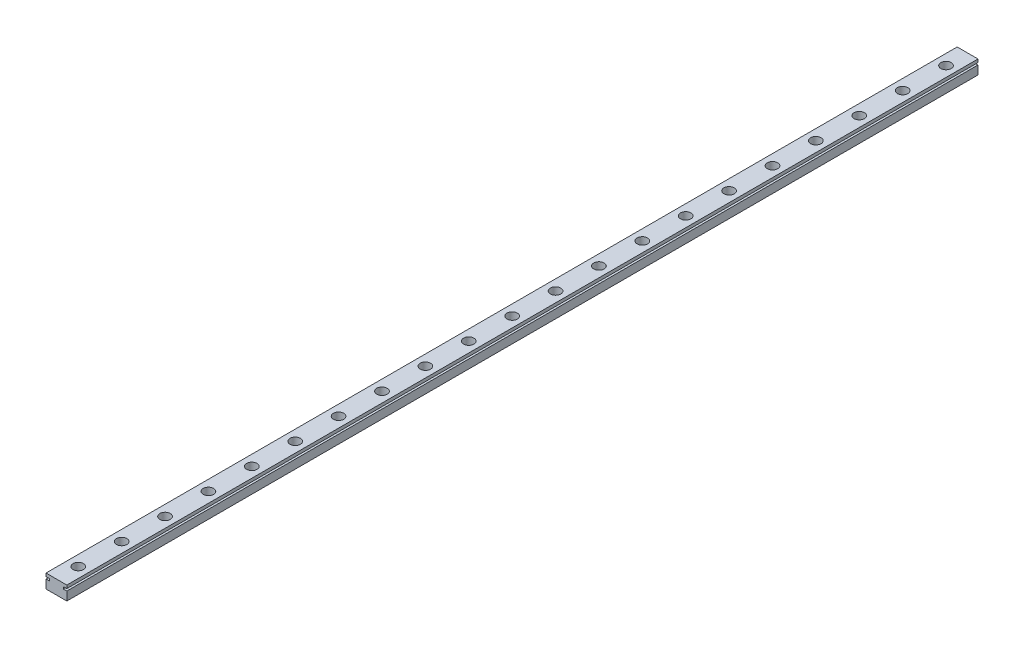
from build123d import *

# Parameters (mm, degrees)
BOSS_EXTRU_1_DEPTH      = 525
ESQUISSE2_R             = 3
ENL_V_MAT_EXTRU_1_DEPTH = 4.5
ENL_V_MAT_EXTRU_2_REACH = 527.109
ESQUISSE3_R             = 1.75


with BuildPart() as part:
    # Esquisse1 → Boss.-Extru.1 (new body)
    with BuildSketch(Plane.XY):
        Polygon((-2.287966089, -3.148854962), (9.712033911, -3.148854962), (9.712033911, 1.851145038), (7.712033911, 1.851145038), (7.712033911, 3.051145038), (9.712033911, 3.051145038), (9.712033911, 4.851145038), (-2.287966089, 4.851145038), (-2.287966089, 3.051145038), (-0.287966089, 3.051145038), (-0.287966089, 1.851145038), (-2.287966089, 1.851145038), align=None)
    extrude(amount=BOSS_EXTRU_1_DEPTH)

    # Esquisse2 → Enlèv. mat.-Extru.1 (cut)
    with BuildSketch(Plane(origin=(0, 4.851145038, 0), x_dir=(1, 0, 0), z_dir=(0, 1, 0))):
        with Locations(Location((3.792841972, -512.5, 0), (0, 0, 180))):
            Circle(ESQUISSE2_R)
        with Locations(Location((3.792841972, -487.5, 0), (0, 0, 180))):
            Circle(ESQUISSE2_R)
        with Locations(Location((3.792841972, -462.5, 0), (0, 0, 180))):
            Circle(ESQUISSE2_R)
        with Locations(Location((3.792841972, -437.5, 0), (0, 0, 180))):
            Circle(ESQUISSE2_R)
        with Locations(Location((3.792841972, -412.5, 0), (0, 0, 180))):
            Circle(ESQUISSE2_R)
        with Locations(Location((3.792841972, -387.5, 0), (0, 0, 180))):
            Circle(ESQUISSE2_R)
        with Locations(Location((3.792841972, -362.5, 0), (0, 0, 180))):
            Circle(ESQUISSE2_R)
        with Locations(Location((3.792841972, -337.5, 0), (0, 0, 180))):
            Circle(ESQUISSE2_R)
        with Locations(Location((3.792841972, -312.5, 0), (0, 0, 180))):
            Circle(ESQUISSE2_R)
        with Locations(Location((3.792841972, -287.5, 0), (0, 0, 180))):
            Circle(ESQUISSE2_R)
        with Locations(Location((3.792841972, -262.5, 0), (0, 0, 180))):
            Circle(ESQUISSE2_R)
        with Locations(Location((3.792841972, -237.5, 0), (0, 0, 180))):
            Circle(ESQUISSE2_R)
        with Locations(Location((3.792841972, -212.5, 0), (0, 0, 180))):
            Circle(ESQUISSE2_R)
        with Locations(Location((3.792841972, -187.5, 0), (0, 0, 180))):
            Circle(ESQUISSE2_R)
        with Locations(Location((3.792841972, -162.5, 0), (0, 0, 180))):
            Circle(ESQUISSE2_R)
        with Locations(Location((3.792841972, -137.5, 0), (0, 0, 180))):
            Circle(ESQUISSE2_R)
        with Locations(Location((3.792841972, -112.5, 0), (0, 0, 180))):
            Circle(ESQUISSE2_R)
        with Locations(Location((3.792841972, -87.5, 0), (0, 0, 180))):
            Circle(ESQUISSE2_R)
        with Locations(Location((3.792841972, -62.5, 0), (0, 0, 180))):
            Circle(ESQUISSE2_R)
        with Locations(Location((3.792841972, -37.5, 0), (0, 0, 180))):
            Circle(ESQUISSE2_R)
        with Locations(Location((3.792841972, -12.5, 0), (0, 0, 180))):
            Circle(ESQUISSE2_R)
    extrude(amount=-ENL_V_MAT_EXTRU_1_DEPTH, mode=Mode.SUBTRACT)

    # Esquisse3 → Enlèv. mat.-Extru.2 (cut, up to next)
    with BuildSketch(Plane(origin=(0, 0.351145038, 0), x_dir=(1, 0, 0), z_dir=(0, 1, 0)), mode=Mode.PRIVATE) as enl_v_mat_extru_2_sk1:
        with Locations(Location((3.792841972, -512.5, 0), (0, 0, 180))):
            Circle(ESQUISSE3_R)
    enl_v_mat_extru_2_tool1 = extrude(enl_v_mat_extru_2_sk1.sketch, amount=-ENL_V_MAT_EXTRU_2_REACH, mode=Mode.PRIVATE) & part.part
    # Esquisse3 → Enlèv. mat.-Extru.2 (cut, up to next)
    with BuildSketch(Plane(origin=(0, 0.351145038, 0), x_dir=(1, 0, 0), z_dir=(0, 1, 0)), mode=Mode.PRIVATE) as enl_v_mat_extru_2_sk2:
        with Locations(Location((3.792841972, -487.5, 0), (0, 0, 180))):
            Circle(ESQUISSE3_R)
    enl_v_mat_extru_2_tool2 = extrude(enl_v_mat_extru_2_sk2.sketch, amount=-ENL_V_MAT_EXTRU_2_REACH, mode=Mode.PRIVATE) & part.part
    # Esquisse3 → Enlèv. mat.-Extru.2 (cut, up to next)
    with BuildSketch(Plane(origin=(0, 0.351145038, 0), x_dir=(1, 0, 0), z_dir=(0, 1, 0)), mode=Mode.PRIVATE) as enl_v_mat_extru_2_sk3:
        with Locations(Location((3.792841972, -462.5, 0), (0, 0, 180))):
            Circle(ESQUISSE3_R)
    enl_v_mat_extru_2_tool3 = extrude(enl_v_mat_extru_2_sk3.sketch, amount=-ENL_V_MAT_EXTRU_2_REACH, mode=Mode.PRIVATE) & part.part
    # Esquisse3 → Enlèv. mat.-Extru.2 (cut, up to next)
    with BuildSketch(Plane(origin=(0, 0.351145038, 0), x_dir=(1, 0, 0), z_dir=(0, 1, 0)), mode=Mode.PRIVATE) as enl_v_mat_extru_2_sk4:
        with Locations(Location((3.792841972, -437.5, 0), (0, 0, 180))):
            Circle(ESQUISSE3_R)
    enl_v_mat_extru_2_tool4 = extrude(enl_v_mat_extru_2_sk4.sketch, amount=-ENL_V_MAT_EXTRU_2_REACH, mode=Mode.PRIVATE) & part.part
    # Esquisse3 → Enlèv. mat.-Extru.2 (cut, up to next)
    with BuildSketch(Plane(origin=(0, 0.351145038, 0), x_dir=(1, 0, 0), z_dir=(0, 1, 0)), mode=Mode.PRIVATE) as enl_v_mat_extru_2_sk5:
        with Locations(Location((3.792841972, -412.5, 0), (0, 0, 180))):
            Circle(ESQUISSE3_R)
    enl_v_mat_extru_2_tool5 = extrude(enl_v_mat_extru_2_sk5.sketch, amount=-ENL_V_MAT_EXTRU_2_REACH, mode=Mode.PRIVATE) & part.part
    # Esquisse3 → Enlèv. mat.-Extru.2 (cut, up to next)
    with BuildSketch(Plane(origin=(0, 0.351145038, 0), x_dir=(1, 0, 0), z_dir=(0, 1, 0)), mode=Mode.PRIVATE) as enl_v_mat_extru_2_sk6:
        with Locations(Location((3.792841972, -387.5, 0), (0, 0, 180))):
            Circle(ESQUISSE3_R)
    enl_v_mat_extru_2_tool6 = extrude(enl_v_mat_extru_2_sk6.sketch, amount=-ENL_V_MAT_EXTRU_2_REACH, mode=Mode.PRIVATE) & part.part
    # Esquisse3 → Enlèv. mat.-Extru.2 (cut, up to next)
    with BuildSketch(Plane(origin=(0, 0.351145038, 0), x_dir=(1, 0, 0), z_dir=(0, 1, 0)), mode=Mode.PRIVATE) as enl_v_mat_extru_2_sk7:
        with Locations(Location((3.792841972, -362.5, 0), (0, 0, 180))):
            Circle(ESQUISSE3_R)
    enl_v_mat_extru_2_tool7 = extrude(enl_v_mat_extru_2_sk7.sketch, amount=-ENL_V_MAT_EXTRU_2_REACH, mode=Mode.PRIVATE) & part.part
    # Esquisse3 → Enlèv. mat.-Extru.2 (cut, up to next)
    with BuildSketch(Plane(origin=(0, 0.351145038, 0), x_dir=(1, 0, 0), z_dir=(0, 1, 0)), mode=Mode.PRIVATE) as enl_v_mat_extru_2_sk8:
        with Locations(Location((3.792841972, -337.5, 0), (0, 0, 180))):
            Circle(ESQUISSE3_R)
    enl_v_mat_extru_2_tool8 = extrude(enl_v_mat_extru_2_sk8.sketch, amount=-ENL_V_MAT_EXTRU_2_REACH, mode=Mode.PRIVATE) & part.part
    # Esquisse3 → Enlèv. mat.-Extru.2 (cut, up to next)
    with BuildSketch(Plane(origin=(0, 0.351145038, 0), x_dir=(1, 0, 0), z_dir=(0, 1, 0)), mode=Mode.PRIVATE) as enl_v_mat_extru_2_sk9:
        with Locations(Location((3.792841972, -312.5, 0), (0, 0, 180))):
            Circle(ESQUISSE3_R)
    enl_v_mat_extru_2_tool9 = extrude(enl_v_mat_extru_2_sk9.sketch, amount=-ENL_V_MAT_EXTRU_2_REACH, mode=Mode.PRIVATE) & part.part
    # Esquisse3 → Enlèv. mat.-Extru.2 (cut, up to next)
    with BuildSketch(Plane(origin=(0, 0.351145038, 0), x_dir=(1, 0, 0), z_dir=(0, 1, 0)), mode=Mode.PRIVATE) as enl_v_mat_extru_2_sk10:
        with Locations(Location((3.792841972, -287.5, 0), (0, 0, 180))):
            Circle(ESQUISSE3_R)
    enl_v_mat_extru_2_tool10 = extrude(enl_v_mat_extru_2_sk10.sketch, amount=-ENL_V_MAT_EXTRU_2_REACH, mode=Mode.PRIVATE) & part.part
    # Esquisse3 → Enlèv. mat.-Extru.2 (cut, up to next)
    with BuildSketch(Plane(origin=(0, 0.351145038, 0), x_dir=(1, 0, 0), z_dir=(0, 1, 0)), mode=Mode.PRIVATE) as enl_v_mat_extru_2_sk11:
        with Locations(Location((3.792841972, -262.5, 0), (0, 0, 180))):
            Circle(ESQUISSE3_R)
    enl_v_mat_extru_2_tool11 = extrude(enl_v_mat_extru_2_sk11.sketch, amount=-ENL_V_MAT_EXTRU_2_REACH, mode=Mode.PRIVATE) & part.part
    # Esquisse3 → Enlèv. mat.-Extru.2 (cut, up to next)
    with BuildSketch(Plane(origin=(0, 0.351145038, 0), x_dir=(1, 0, 0), z_dir=(0, 1, 0)), mode=Mode.PRIVATE) as enl_v_mat_extru_2_sk12:
        with Locations(Location((3.792841972, -237.5, 0), (0, 0, 180))):
            Circle(ESQUISSE3_R)
    enl_v_mat_extru_2_tool12 = extrude(enl_v_mat_extru_2_sk12.sketch, amount=-ENL_V_MAT_EXTRU_2_REACH, mode=Mode.PRIVATE) & part.part
    # Esquisse3 → Enlèv. mat.-Extru.2 (cut, up to next)
    with BuildSketch(Plane(origin=(0, 0.351145038, 0), x_dir=(1, 0, 0), z_dir=(0, 1, 0)), mode=Mode.PRIVATE) as enl_v_mat_extru_2_sk13:
        with Locations(Location((3.792841972, -212.5, 0), (0, 0, 180))):
            Circle(ESQUISSE3_R)
    enl_v_mat_extru_2_tool13 = extrude(enl_v_mat_extru_2_sk13.sketch, amount=-ENL_V_MAT_EXTRU_2_REACH, mode=Mode.PRIVATE) & part.part
    # Esquisse3 → Enlèv. mat.-Extru.2 (cut, up to next)
    with BuildSketch(Plane(origin=(0, 0.351145038, 0), x_dir=(1, 0, 0), z_dir=(0, 1, 0)), mode=Mode.PRIVATE) as enl_v_mat_extru_2_sk14:
        with Locations(Location((3.792841972, -187.5, 0), (0, 0, 180))):
            Circle(ESQUISSE3_R)
    enl_v_mat_extru_2_tool14 = extrude(enl_v_mat_extru_2_sk14.sketch, amount=-ENL_V_MAT_EXTRU_2_REACH, mode=Mode.PRIVATE) & part.part
    # Esquisse3 → Enlèv. mat.-Extru.2 (cut, up to next)
    with BuildSketch(Plane(origin=(0, 0.351145038, 0), x_dir=(1, 0, 0), z_dir=(0, 1, 0)), mode=Mode.PRIVATE) as enl_v_mat_extru_2_sk15:
        with Locations(Location((3.792841972, -162.5, 0), (0, 0, 180))):
            Circle(ESQUISSE3_R)
    enl_v_mat_extru_2_tool15 = extrude(enl_v_mat_extru_2_sk15.sketch, amount=-ENL_V_MAT_EXTRU_2_REACH, mode=Mode.PRIVATE) & part.part
    # Esquisse3 → Enlèv. mat.-Extru.2 (cut, up to next)
    with BuildSketch(Plane(origin=(0, 0.351145038, 0), x_dir=(1, 0, 0), z_dir=(0, 1, 0)), mode=Mode.PRIVATE) as enl_v_mat_extru_2_sk16:
        with Locations(Location((3.792841972, -137.5, 0), (0, 0, 180))):
            Circle(ESQUISSE3_R)
    enl_v_mat_extru_2_tool16 = extrude(enl_v_mat_extru_2_sk16.sketch, amount=-ENL_V_MAT_EXTRU_2_REACH, mode=Mode.PRIVATE) & part.part
    # Esquisse3 → Enlèv. mat.-Extru.2 (cut, up to next)
    with BuildSketch(Plane(origin=(0, 0.351145038, 0), x_dir=(1, 0, 0), z_dir=(0, 1, 0)), mode=Mode.PRIVATE) as enl_v_mat_extru_2_sk17:
        with Locations(Location((3.792841972, -112.5, 0), (0, 0, 180))):
            Circle(ESQUISSE3_R)
    enl_v_mat_extru_2_tool17 = extrude(enl_v_mat_extru_2_sk17.sketch, amount=-ENL_V_MAT_EXTRU_2_REACH, mode=Mode.PRIVATE) & part.part
    # Esquisse3 → Enlèv. mat.-Extru.2 (cut, up to next)
    with BuildSketch(Plane(origin=(0, 0.351145038, 0), x_dir=(1, 0, 0), z_dir=(0, 1, 0)), mode=Mode.PRIVATE) as enl_v_mat_extru_2_sk18:
        with Locations(Location((3.792841972, -87.5, 0), (0, 0, 180))):
            Circle(ESQUISSE3_R)
    enl_v_mat_extru_2_tool18 = extrude(enl_v_mat_extru_2_sk18.sketch, amount=-ENL_V_MAT_EXTRU_2_REACH, mode=Mode.PRIVATE) & part.part
    # Esquisse3 → Enlèv. mat.-Extru.2 (cut, up to next)
    with BuildSketch(Plane(origin=(0, 0.351145038, 0), x_dir=(1, 0, 0), z_dir=(0, 1, 0)), mode=Mode.PRIVATE) as enl_v_mat_extru_2_sk19:
        with Locations(Location((3.792841972, -62.5, 0), (0, 0, 180))):
            Circle(ESQUISSE3_R)
    enl_v_mat_extru_2_tool19 = extrude(enl_v_mat_extru_2_sk19.sketch, amount=-ENL_V_MAT_EXTRU_2_REACH, mode=Mode.PRIVATE) & part.part
    # Esquisse3 → Enlèv. mat.-Extru.2 (cut, up to next)
    with BuildSketch(Plane(origin=(0, 0.351145038, 0), x_dir=(1, 0, 0), z_dir=(0, 1, 0)), mode=Mode.PRIVATE) as enl_v_mat_extru_2_sk20:
        with Locations(Location((3.792841972, -37.5, 0), (0, 0, 180))):
            Circle(ESQUISSE3_R)
    enl_v_mat_extru_2_tool20 = extrude(enl_v_mat_extru_2_sk20.sketch, amount=-ENL_V_MAT_EXTRU_2_REACH, mode=Mode.PRIVATE) & part.part
    # Esquisse3 → Enlèv. mat.-Extru.2 (cut, up to next)
    with BuildSketch(Plane(origin=(0, 0.351145038, 0), x_dir=(1, 0, 0), z_dir=(0, 1, 0)), mode=Mode.PRIVATE) as enl_v_mat_extru_2_sk21:
        with Locations(Location((3.792841972, -12.5, 0), (0, 0, 180))):
            Circle(ESQUISSE3_R)
    enl_v_mat_extru_2_tool21 = extrude(enl_v_mat_extru_2_sk21.sketch, amount=-ENL_V_MAT_EXTRU_2_REACH, mode=Mode.PRIVATE) & part.part
    add(enl_v_mat_extru_2_tool1.solids().sort_by_distance((3.792842, 0.351145, 512.5))[0], mode=Mode.SUBTRACT)
    add(enl_v_mat_extru_2_tool2.solids().sort_by_distance((3.792842, 0.351145, 487.5))[0], mode=Mode.SUBTRACT)
    add(enl_v_mat_extru_2_tool3.solids().sort_by_distance((3.792842, 0.351145, 462.5))[0], mode=Mode.SUBTRACT)
    add(enl_v_mat_extru_2_tool4.solids().sort_by_distance((3.792842, 0.351145, 437.5))[0], mode=Mode.SUBTRACT)
    add(enl_v_mat_extru_2_tool5.solids().sort_by_distance((3.792842, 0.351145, 412.5))[0], mode=Mode.SUBTRACT)
    add(enl_v_mat_extru_2_tool6.solids().sort_by_distance((3.792842, 0.351145, 387.5))[0], mode=Mode.SUBTRACT)
    add(enl_v_mat_extru_2_tool7.solids().sort_by_distance((3.792842, 0.351145, 362.5))[0], mode=Mode.SUBTRACT)
    add(enl_v_mat_extru_2_tool8.solids().sort_by_distance((3.792842, 0.351145, 337.5))[0], mode=Mode.SUBTRACT)
    add(enl_v_mat_extru_2_tool9.solids().sort_by_distance((3.792842, 0.351145, 312.5))[0], mode=Mode.SUBTRACT)
    add(enl_v_mat_extru_2_tool10.solids().sort_by_distance((3.792842, 0.351145, 287.5))[0], mode=Mode.SUBTRACT)
    add(enl_v_mat_extru_2_tool11.solids().sort_by_distance((3.792842, 0.351145, 262.5))[0], mode=Mode.SUBTRACT)
    add(enl_v_mat_extru_2_tool12.solids().sort_by_distance((3.792842, 0.351145, 237.5))[0], mode=Mode.SUBTRACT)
    add(enl_v_mat_extru_2_tool13.solids().sort_by_distance((3.792842, 0.351145, 212.5))[0], mode=Mode.SUBTRACT)
    add(enl_v_mat_extru_2_tool14.solids().sort_by_distance((3.792842, 0.351145, 187.5))[0], mode=Mode.SUBTRACT)
    add(enl_v_mat_extru_2_tool15.solids().sort_by_distance((3.792842, 0.351145, 162.5))[0], mode=Mode.SUBTRACT)
    add(enl_v_mat_extru_2_tool16.solids().sort_by_distance((3.792842, 0.351145, 137.5))[0], mode=Mode.SUBTRACT)
    add(enl_v_mat_extru_2_tool17.solids().sort_by_distance((3.792842, 0.351145, 112.5))[0], mode=Mode.SUBTRACT)
    add(enl_v_mat_extru_2_tool18.solids().sort_by_distance((3.792842, 0.351145, 87.5))[0], mode=Mode.SUBTRACT)
    add(enl_v_mat_extru_2_tool19.solids().sort_by_distance((3.792842, 0.351145, 62.5))[0], mode=Mode.SUBTRACT)
    add(enl_v_mat_extru_2_tool20.solids().sort_by_distance((3.792842, 0.351145, 37.5))[0], mode=Mode.SUBTRACT)
    add(enl_v_mat_extru_2_tool21.solids().sort_by_distance((3.792842, 0.351145, 12.5))[0], mode=Mode.SUBTRACT)


solid = part.part
